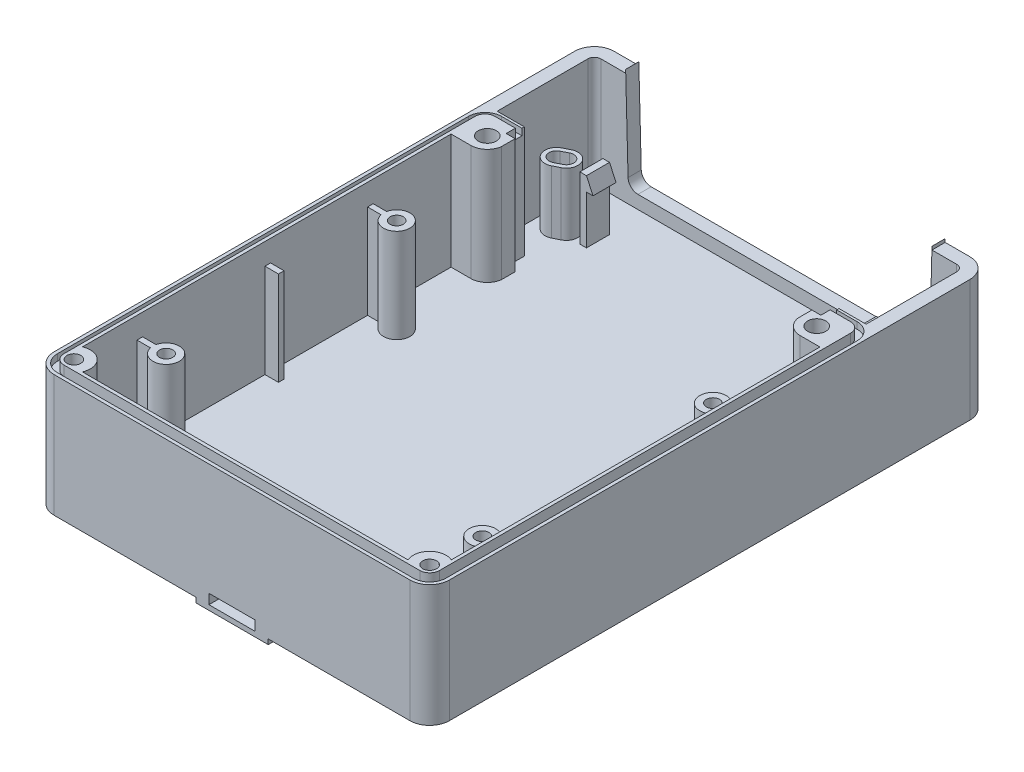
from build123d import *

# Parameters (mm, degrees)
SALIENTE_EXTRUIR1_DEPTH       = 38
SALIENTE_EXTRUIR2_DEPTH       = 1.5
CORTAR_EXTRUIR2_DEPTH         = 6.3
SALIENTE_EXTRUIR3_DEPTH       = 1.5
CORTAR_EXTRUIR3_DEPTH         = 35
SALIENTE_EXTRUIR4_DEPTH       = 6
CROQUIS7_R                    = 4
CROQUIS7_R_2                  = 2
SALIENTE_EXTRUIR5_DEPTH       = 28.5
CORTAR_EXTRUIR4_DEPTH         = 35
CROQUIS9_R                    = 2.75
CORTAR_EXTRUIR5_DEPTH         = 8
CORTAR_EXTRUIR11_DEPTH        = 13
CORTAR_EXTRUIR12_DEPTH        = 6
SALIENTE_EXTRUIR6_DEPTH       = 7
CORTAR_EXTRUIR13_DEPTH        = 3
CORTAR_EXTRUIR14_DEPTH        = 1
CROQUIS16_R                   = 2.1
CORTAR_EXTRUIR15_DEPTH        = 4
CROQUIS17_R                   = 3.6
CORTAR_EXTRUIR16_DEPTH        = 60
CROQUIS20_W                   = 4.091355734
CROQUIS20_H                   = 1.7
CROQUIS20_W_2                 = 2
CROQUIS20_H_2                 = 3.5
SALIENTE_EXTRUIR9_DEPTH       = 28.5
SALIENTE_EXTRUIR10_DEPTH      = 1
SALIENTE_EXTRUIR10_DEPTH_BACK = 1
SALIENTE_EXTRUIR11_START      = 19
SALIENTE_EXTRUIR11_DEPTH      = 19


with BuildPart() as part:
    # Croquis1 → Saliente-Extruir1 (new body)
    with BuildSketch(Plane(origin=(0, 0, 0), x_dir=(1, 0, 0), z_dir=(0, 1, 0))):
        with BuildLine():
            Line((-54, 85), (54, 85))
            ThreePointArc((54, 85), (58.242640687, 83.242640687), (60, 79))
            Line((60, 79), (60, -79))
            ThreePointArc((60, -79), (58.242640687, -83.242640687), (54, -85))
            Line((54, -85), (-54, -85))
            ThreePointArc((-54, -85), (-58.242640687, -83.242640687), (-60, -79))
            Line((-60, -79), (-60, 79))
            ThreePointArc((-60, 79), (-58.242640687, 83.242640687), (-54, 85))
        make_face()
    extrude(amount=SALIENTE_EXTRUIR1_DEPTH)

    # Croquis2 → Saliente-Extruir2 (add)
    with BuildSketch(Plane.XZ):
        with BuildLine():
            Line((11, 56.5), (11, 85))
            Line((11, 85), (-11, 85))
            Line((-11, 85), (-11, 56.5))
            ThreePointArc((-11, 56.5), (-10.560660172, 55.439339828), (-9.5, 55))
            Line((-9.5, 55), (9.5, 55))
            ThreePointArc((9.5, 55), (10.560660172, 55.439339828), (11, 56.5))
        make_face()
        with BuildLine():
            Line((7, 59), (-7, 59))
            Line((-7, 59), (-7, 70))
            Line((-7, 70), (-3, 77.231097548))
            ThreePointArc((-3, 77.231097548), (0, 79), (3, 77.231097548))
            Line((3, 77.231097548), (7, 70))
            Line((7, 70), (7, 59))
        make_face(mode=Mode.SUBTRACT)
    extrude(amount=SALIENTE_EXTRUIR2_DEPTH)

    # Croquis3 → Cortar-Extruir2 (cut)
    with BuildSketch(Plane(origin=(0, 6.3, 0), x_dir=(-1, 0, 0), z_dir=(0, -1, 0))):
        Polygon((-7, -59), (-7, -70), (-7, -87.26562292), (7, -87.26562292), (7, -70), (7, -59), align=None)
    extrude(amount=CORTAR_EXTRUIR2_DEPTH, mode=Mode.SUBTRACT)

    # Croquis4 → Saliente-Extruir3 (add)
    # profile 1 of 2: a face of its own
    with BuildSketch(Plane.XZ):
        with BuildLine():
            Line((-48.434752416, -60.369504832), (-46.434752416, -61.369504832))
            ThreePointArc((-46.434752416, -61.369504832), (-44.869504832, -66.065247584), (-49.565247584, -67.630495168))
            Line((-49.565247584, -67.630495168), (-51.565247584, -66.630495168))
            ThreePointArc((-51.565247584, -66.630495168), (-53.130495168, -61.934752416), (-48.434752416, -60.369504832))
        make_face()
        with BuildLine():
            Line((-48.99376941, -61.48753882), (-46.99376941, -62.48753882))
            ThreePointArc((-46.99376941, -62.48753882), (-45.98753882, -65.50623059), (-49.00623059, -66.51246118))
            Line((-49.00623059, -66.51246118), (-51.00623059, -65.51246118))
            ThreePointArc((-51.00623059, -65.51246118), (-52.01246118, -62.49376941), (-48.99376941, -61.48753882))
        make_face(mode=Mode.SUBTRACT)
    # profile 2 of 2: a face of its own
    with BuildSketch(Plane.XZ):
        with BuildLine():
            Line((51.565247584, -66.630495168), (49.565247584, -67.630495168))
            ThreePointArc((49.565247584, -67.630495168), (44.869504832, -66.065247584), (46.434752416, -61.369504832))
            Line((46.434752416, -61.369504832), (48.434752416, -60.369504832))
            ThreePointArc((48.434752416, -60.369504832), (53.130495168, -61.934752416), (51.565247584, -66.630495168))
        make_face()
        with BuildLine():
            Line((51.00623059, -65.51246118), (49.00623059, -66.51246118))
            ThreePointArc((49.00623059, -66.51246118), (45.98753882, -65.50623059), (46.99376941, -62.48753882))
            Line((46.99376941, -62.48753882), (48.99376941, -61.48753882))
            ThreePointArc((48.99376941, -61.48753882), (52.01246118, -62.49376941), (51.00623059, -65.51246118))
        make_face(mode=Mode.SUBTRACT)
    extrude(amount=SALIENTE_EXTRUIR3_DEPTH)

    # Croquis5 → Cortar-Extruir3 (cut)
    with BuildSketch(Plane(origin=(0, 38, 0), x_dir=(1, 0, 0), z_dir=(0, 1, 0))):
        with BuildLine():
            ThreePointArc((-50, 37.5), (-46.483645962, 38.945389715), (-45.000292708, 42.445898288))
            Line((-45.000292708, 42.445898288), (45.000292708, 42.445898288))
            ThreePointArc((45.000292708, 42.445898288), (46.483645962, 38.945389715), (50, 37.5))
            Line((50, 37.5), (56, 37.5))
            Line((56, 37.5), (56, -74.417424305))
            ThreePointArc((56, -74.417424305), (50.464466094, -75.464466094), (49.417424305, -81))
            Line((49.417424305, -81), (-49.417424305, -81))
            ThreePointArc((-49.417424305, -81), (-50.464466094, -75.464466094), (-56, -74.417424305))
            Line((-56, -74.417424305), (-56, 37.5))
            Line((-56, 37.5), (-50, 37.5))
        make_face()
    extrude(amount=-CORTAR_EXTRUIR3_DEPTH, mode=Mode.SUBTRACT)

    # Croquis6 → Saliente-Extruir4 (add)
    with BuildSketch(Plane(origin=(0, 3, 0), x_dir=(1, 0, 0), z_dir=(0, 1, 0))):
        with BuildLine():
            Line((10.097429622, -85), (-9.902570378, -85))
            Line((-9.902570378, -85), (-9.902570378, -57.5))
            ThreePointArc((-9.902570378, -57.5), (-9.46323055, -56.439339828), (-8.402570378, -56))
            Line((-8.402570378, -56), (8.597429622, -56))
            ThreePointArc((8.597429622, -56), (9.658089794, -56.439339828), (10.097429622, -57.5))
            Line((10.097429622, -57.5), (10.097429622, -85))
        make_face()
    extrude(amount=SALIENTE_EXTRUIR4_DEPTH)

    # Croquis7 → Saliente-Extruir5 (add)
    # profile 1 of 4: a face of its own
    with BuildSketch(Plane(origin=(0, 3, 0), x_dir=(1, 0, 0), z_dir=(0, 1, 0))):
        with Locations(Location((48, -57, 0), (0, 0, 90))):
            Circle(CROQUIS7_R)
        with Locations(Location((48, -57, 0), (0, 0, 90))):
            Circle(CROQUIS7_R_2, mode=Mode.SUBTRACT)
    # profile 2 of 4: a face of its own
    with BuildSketch(Plane(origin=(0, 3, 0), x_dir=(1, 0, 0), z_dir=(0, 1, 0))):
        with Locations(Location((48, 13, 0), (0, 0, 90))):
            Circle(CROQUIS7_R)
        with Locations(Location((48, 13, 0), (0, 0, 90))):
            Circle(CROQUIS7_R_2, mode=Mode.SUBTRACT)
    # profile 3 of 4: a face of its own
    with BuildSketch(Plane(origin=(0, 3, 0), x_dir=(1, 0, 0), z_dir=(0, 1, 0))):
        with Locations(Location((-48, 13, 0), (0, 0, 90))):
            Circle(CROQUIS7_R)
        with Locations(Location((-48, 13, 0), (0, 0, 90))):
            Circle(CROQUIS7_R_2, mode=Mode.SUBTRACT)
    # profile 4 of 4: a face of its own
    with BuildSketch(Plane(origin=(0, 3, 0), x_dir=(1, 0, 0), z_dir=(0, 1, 0))):
        with Locations(Location((-48, -57, 0), (0, 0, 90))):
            Circle(CROQUIS7_R)
        with Locations(Location((-48, -57, 0), (0, 0, 90))):
            Circle(CROQUIS7_R_2, mode=Mode.SUBTRACT)
    extrude(amount=SALIENTE_EXTRUIR5_DEPTH)

    # Croquis8 → Cortar-Extruir4 (cut)
    with BuildSketch(Plane(origin=(0, 38, 0), x_dir=(1, 0, 0), z_dir=(0, 1, 0))):
        with BuildLine():
            Line((-45.05, 46), (-45.05, 41.794663201))
            ThreePointArc((-45.05, 41.794663201), (-45.014501471, 42.119468245), (-45.000292708, 42.445898288))
            Line((-45.000292708, 42.445898288), (45.000292708, 42.445898288))
            ThreePointArc((45.000292708, 42.445898288), (45.014501471, 42.119468245), (45.05, 41.794663201))
            Line((45.05, 41.794663201), (45.05, 46))
            Line((45.05, 46), (47.773447287, 46))
            Line((47.773447287, 46), (47.773447287, 51.5))
            Line((47.773447287, 51.5), (56, 51.5))
            Line((56, 51.5), (56, 79))
            ThreePointArc((56, 79), (55.414213562, 80.414213562), (54, 81))
            Line((54, 81), (47, 81))
            Line((47, 81), (-47, 81))
            Line((-47, 81), (-54, 81))
            ThreePointArc((-54, 81), (-55.414213562, 80.414213562), (-56, 79))
            Line((-56, 79), (-56, 51.5))
            Line((-56, 51.5), (-47.773447287, 51.5))
            Line((-47.773447287, 51.5), (-47.773447287, 46))
            Line((-47.773447287, 46), (-45.05, 46))
        make_face()
    extrude(amount=-CORTAR_EXTRUIR4_DEPTH, mode=Mode.SUBTRACT)

    # Croquis9 → Cortar-Extruir5 (cut)
    with BuildSketch(Plane(origin=(0, 38, 0), x_dir=(1, 0, 0), z_dir=(0, 1, 0))):
        with Locations(Location((50, 42.5, 0), (0, 0, 270))):
            Circle(CROQUIS9_R)
        with Locations(Location((-50, 42.5, 0), (0, 0, 270))):
            Circle(CROQUIS9_R)
    extrude(amount=-CORTAR_EXTRUIR5_DEPTH, mode=Mode.SUBTRACT)

    # Croquis10 → Cortar-Extruir11 (cut)
    with BuildSketch(Plane.XZ):
        with BuildLine():
            Line((50, -39.5), (57.5, -39.5))
            Line((57.5, -39.5), (57.5, -49))
            Line((57.5, -49), (50, -49))
            Line((50, -49), (50, -42.5))
            Line((50, -42.5), (47, -42.5))
            ThreePointArc((47, -42.5), (47.878679656, -40.378679656), (50, -39.5))
        make_face()
        with BuildLine():
            ThreePointArc((-50, -39.5), (-47.878679656, -40.378679656), (-47, -42.5))
            Line((-47, -42.5), (-50, -42.5))
            Line((-50, -42.5), (-50, -49))
            Line((-50, -49), (-57.5, -49))
            Line((-57.5, -49), (-57.5, -39.5))
            Line((-57.5, -39.5), (-50, -39.5))
        make_face()
    extrude(amount=-CORTAR_EXTRUIR11_DEPTH, mode=Mode.SUBTRACT)

    # Croquis12 → Cortar-Extruir12 (cut)
    with BuildSketch(Plane(origin=(0, 0, -85), x_dir=(-1, 0, 0), z_dir=(0, 0, -1))):
        with BuildLine():
            Line((45.650124043, 38), (-45.650124043, 38))
            Line((-45.650124043, 38), (-46.5, 38))
            Line((-46.5, 38), (-45.764737794, 9.921469155))
            ThreePointArc((-45.764737794, 9.921469155), (-44.859137198, 7.85109417), (-42.765765819, 7))
            Line((-42.765765819, 7), (42.765765819, 7))
            ThreePointArc((42.765765819, 7), (44.859137198, 7.85109417), (45.764737794, 9.921469155))
            Line((45.764737794, 9.921469155), (46.5, 38))
            Line((46.5, 38), (45.650124043, 38))
        make_face()
    extrude(amount=-CORTAR_EXTRUIR12_DEPTH, mode=Mode.SUBTRACT)

    # Croquis13 → Saliente-Extruir6 (add)
    with BuildSketch(Plane(origin=(0, 0, -63.1), x_dir=(-1, 0, 0), z_dir=(0, 0, -1))):
        Polygon((-40.5, 3), (-40.5, 17.7), (-38.5, 17.7), (-40.5, 22), (-42.5, 22), (-42.5, 3), align=None)
        Polygon((42.5, 3), (40.5, 3), (40.5, 17.7), (38.5, 17.7), (40.5, 22), (42.5, 22), align=None)
    extrude(amount=SALIENTE_EXTRUIR6_DEPTH)

    # Croquis14 → Cortar-Extruir13 (cut)
    with BuildSketch(Plane(origin=(0, 38, 0), x_dir=(1, 0, 0), z_dir=(0, 1, 0))):
        with BuildLine():
            Line((-59, 45.8), (-59, -79))
            ThreePointArc((-59, -79), (-57.535533906, -82.535533906), (-54, -84))
            Line((-54, -84), (54, -84))
            ThreePointArc((54, -84), (57.535533906, -82.535533906), (59, -79))
            Line((59, -79), (59, 45.8))
            ThreePointArc((59, 45.8), (57.535533906, 49.335533906), (54, 50.8))
            Line((54, 50.8), (-54, 50.8))
            ThreePointArc((-54, 50.8), (-57.535533906, 49.335533906), (-59, 45.8))
        make_face()
        with BuildLine():
            Line((-57, 45.8), (-57, -79))
            ThreePointArc((-57, -79), (-56.121320344, -81.121320344), (-54, -82))
            Line((-54, -82), (54, -82))
            ThreePointArc((54, -82), (56.121320344, -81.121320344), (57, -79))
            Line((57, -79), (57, 45.8))
            ThreePointArc((57, 45.8), (56.121320344, 47.921320344), (54, 48.8))
            Line((54, 48.8), (-54, 48.8))
            ThreePointArc((-54, 48.8), (-56.121320344, 47.921320344), (-57, 45.8))
        make_face(mode=Mode.SUBTRACT)
    extrude(amount=-CORTAR_EXTRUIR13_DEPTH, mode=Mode.SUBTRACT)

    # Croquis15 → Cortar-Extruir14 (cut)
    with BuildSketch(Plane(origin=(0, 38, 0), x_dir=(1, 0, 0), z_dir=(0, 1, 0))):
        with BuildLine():
            Line((60, -79), (60, 79))
            ThreePointArc((60, 79), (58.242640687, 83.242640687), (54, 85))
            Line((54, 85), (46.5, 85))
            Line((46.5, 85), (46.5, 81))
            Line((46.5, 81), (54, 81))
            ThreePointArc((54, 81), (55.414213562, 80.414213562), (56, 79))
            Line((56, 79), (56, 51.5))
            Line((56, 51.5), (47.773447287, 51.5))
            Line((47.773447287, 51.5), (47.773447287, 50.8))
            Line((47.773447287, 50.8), (54, 50.8))
            ThreePointArc((54, 50.8), (57.535533906, 49.335533906), (59, 45.8))
            Line((59, 45.8), (59, -79))
            ThreePointArc((59, -79), (57.535533906, -82.535533906), (54, -84))
            Line((54, -84), (-54, -84))
            ThreePointArc((-54, -84), (-57.535533906, -82.535533906), (-59, -79))
            Line((-59, -79), (-59, 45.8))
            ThreePointArc((-59, 45.8), (-57.535533906, 49.335533906), (-54, 50.8))
            Line((-54, 50.8), (-47.773447287, 50.8))
            Line((-47.773447287, 50.8), (-47.773447287, 51.5))
            Line((-47.773447287, 51.5), (-56, 51.5))
            Line((-56, 51.5), (-56, 79))
            ThreePointArc((-56, 79), (-55.414213562, 80.414213562), (-54, 81))
            Line((-54, 81), (-46.5, 81))
            Line((-46.5, 81), (-46.5, 85))
            Line((-46.5, 85), (-54, 85))
            ThreePointArc((-54, 85), (-58.242640687, 83.242640687), (-60, 79))
            Line((-60, 79), (-60, -79))
            ThreePointArc((-60, -79), (-58.242640687, -83.242640687), (-54, -85))
            Line((-54, -85), (54, -85))
            ThreePointArc((54, -85), (58.242640687, -83.242640687), (60, -79))
        make_face()
    extrude(amount=-CORTAR_EXTRUIR14_DEPTH, mode=Mode.SUBTRACT)

    # Croquis16 → Cortar-Extruir15 (cut)
    with BuildSketch(Plane(origin=(0, 38, 0), x_dir=(1, 0, 0), z_dir=(0, 1, 0))):
        with Locations(Location((54, -79, 0), (0, 0, 270))):
            Circle(CROQUIS16_R)
        with Locations(Location((-54, -79, 0), (0, 0, 270))):
            Circle(CROQUIS16_R)
    extrude(amount=-CORTAR_EXTRUIR15_DEPTH, mode=Mode.SUBTRACT)

    # Croquis17 → Cortar-Extruir16 (cut)
    with BuildSketch(Plane(origin=(0, 34, 0), x_dir=(1, 0, 0), z_dir=(0, 1, 0))):
        with Locations(Location((54, -79, 0), (0, 0, 270))):
            Circle(CROQUIS17_R)
        with Locations(Location((-54, -79, 0), (0, 0, 270))):
            Circle(CROQUIS17_R)
    extrude(amount=-CORTAR_EXTRUIR16_DEPTH, mode=Mode.SUBTRACT)

    # Croquis20 → Saliente-Extruir9 (add)
    with BuildSketch(Plane(origin=(0, 3, 0), x_dir=(1, 0, 0), z_dir=(0, 1, 0))):
        with BuildLine():
            Line((51.908644266, 12.15), (56, 12.15))
            Line((56, 12.15), (56, 13.85))
            Line((56, 13.85), (51.908644266, 13.85))
            ThreePointArc((51.908644266, 13.85), (51.977095489, 13.42744762), (52, 13))
            ThreePointArc((52, 13), (51.977095489, 12.57255238), (51.908644266, 12.15))
        make_face()
        with BuildLine():
            Line((-51.908644266, 13.85), (-56, 13.85))
            Line((-56, 13.85), (-56, 12.15))
            Line((-56, 12.15), (-51.908644266, 12.15))
            ThreePointArc((-51.908644266, 12.15), (-52, 13), (-51.908644266, 13.85))
        make_face()
        with Locations((-53.954322133, -18.15)):
            Rectangle(CROQUIS20_W, CROQUIS20_H)
        with Locations((53.954322133, -18.15)):
            Rectangle(CROQUIS20_W, CROQUIS20_H)
        with BuildLine():
            Line((51.908644266, -57.85), (56, -57.85))
            Line((56, -57.85), (56, -56.15))
            Line((56, -56.15), (51.908644266, -56.15))
            ThreePointArc((51.908644266, -56.15), (51.977095489, -56.57255238), (52, -57))
            ThreePointArc((52, -57), (51.977095489, -57.42744762), (51.908644266, -57.85))
        make_face()
        with BuildLine():
            Line((-51.908644266, -56.15), (-56, -56.15))
            Line((-56, -56.15), (-56, -57.85))
            Line((-56, -57.85), (-51.908644266, -57.85))
            ThreePointArc((-51.908644266, -57.85), (-52, -57), (-51.908644266, -56.15))
        make_face()
        with Locations((-17.5, -79.25)):
            Rectangle(CROQUIS20_W_2, CROQUIS20_H_2)
        with Locations((17.5, -79.25)):
            Rectangle(CROQUIS20_W_2, CROQUIS20_H_2)
    extrude(amount=SALIENTE_EXTRUIR9_DEPTH)

    # Croquis21 → Saliente-Extruir10 (add, two sides: drawn at the far end of the back side and taken through both)
    with BuildSketch(Plane(origin=(0, 0, -66.6), x_dir=(-1, 0, 0), z_dir=(0, 0, -1)).offset(-SALIENTE_EXTRUIR10_DEPTH_BACK)):
        Polygon((-42.5, 14.889472652), (-42.5, 3), (-44.387043854, 3), align=None)
        Polygon((44.387043854, 3), (42.5, 14.889472652), (42.5, 3), align=None)
    extrude(amount=SALIENTE_EXTRUIR10_DEPTH + SALIENTE_EXTRUIR10_DEPTH_BACK)

    # Croquis22 → Saliente-Extruir11 (add)
    # profile 1 of 2: a face of its own
    with BuildSketch(Plane(origin=(0, 3, 0), x_dir=(1, 0, 0), z_dir=(0, 1, 0)).offset(SALIENTE_EXTRUIR11_START)):
        with BuildLine():
            Line((51.565247584, 66.630495168), (49.565247584, 67.630495168))
            ThreePointArc((49.565247584, 67.630495168), (44.869504832, 66.065247584), (46.434752416, 61.369504832))
            Line((46.434752416, 61.369504832), (48.434752416, 60.369504832))
            ThreePointArc((48.434752416, 60.369504832), (53.130495168, 61.934752416), (51.565247584, 66.630495168))
        make_face()
        with BuildLine():
            Line((51.00623059, 65.51246118), (49.00623059, 66.51246118))
            ThreePointArc((49.00623059, 66.51246118), (45.98753882, 65.50623059), (46.99376941, 62.48753882))
            Line((46.99376941, 62.48753882), (48.99376941, 61.48753882))
            ThreePointArc((48.99376941, 61.48753882), (52.01246118, 62.49376941), (51.00623059, 65.51246118))
        make_face(mode=Mode.SUBTRACT)
    # profile 2 of 2: a face of its own
    with BuildSketch(Plane(origin=(0, 3, 0), x_dir=(1, 0, 0), z_dir=(0, 1, 0)).offset(SALIENTE_EXTRUIR11_START)):
        with BuildLine():
            Line((-51.565247584, 66.630495168), (-49.565247584, 67.630495168))
            ThreePointArc((-49.565247584, 67.630495168), (-44.869504832, 66.065247584), (-46.434752416, 61.369504832))
            Line((-46.434752416, 61.369504832), (-48.434752416, 60.369504832))
            ThreePointArc((-48.434752416, 60.369504832), (-53.130495168, 61.934752416), (-51.565247584, 66.630495168))
        make_face()
        with BuildLine():
            Line((-51.00623059, 65.51246118), (-49.00623059, 66.51246118))
            ThreePointArc((-49.00623059, 66.51246118), (-45.98753882, 65.50623059), (-46.99376941, 62.48753882))
            Line((-46.99376941, 62.48753882), (-48.99376941, 61.48753882))
            ThreePointArc((-48.99376941, 61.48753882), (-52.01246118, 62.49376941), (-51.00623059, 65.51246118))
        make_face(mode=Mode.SUBTRACT)
    extrude(amount=-SALIENTE_EXTRUIR11_DEPTH)


solid = part.part
